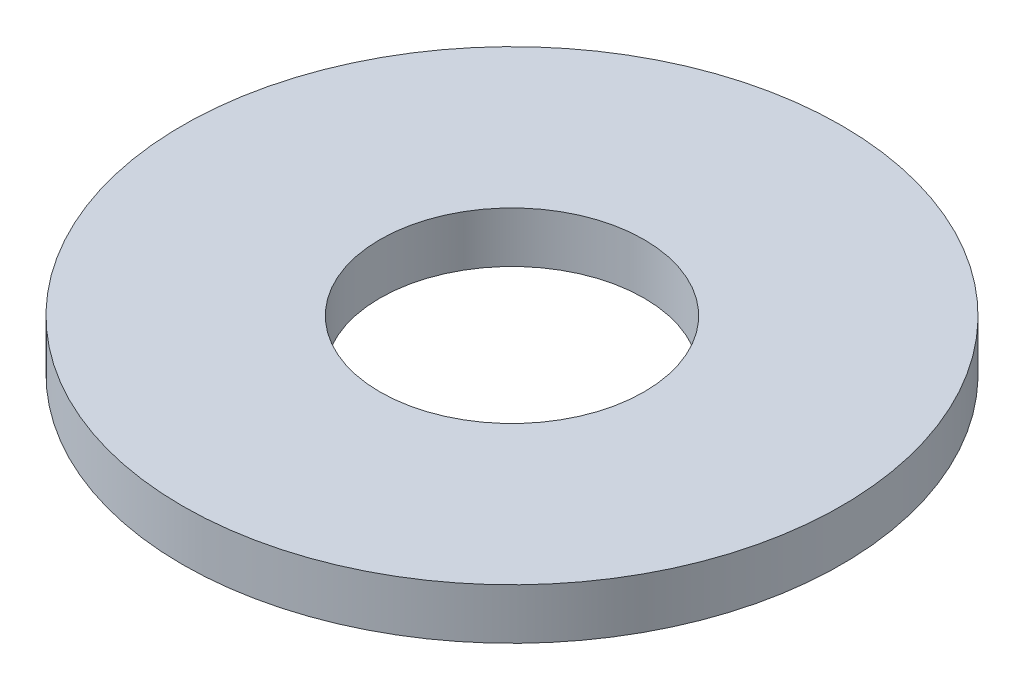
from build123d import *

# Parameters (mm, degrees)
SKETCH1_R           = 3.9624
BOSS_EXTRUDE1_DEPTH = 0.6096
SKETCH5_R           = 1.5875
CUT_EXTRUDE1_DEPTH  = 6.636740164


with BuildPart() as part:
    # Sketch1 → Boss-Extrude1 (new body)
    with BuildSketch(Plane(origin=(0, 0, 0), x_dir=(1, 0, 0), z_dir=(0, 1, 0))):
        with Locations(Location((0, 0, 0), (0, 0, 270))):
            Circle(SKETCH1_R)
    extrude(amount=BOSS_EXTRUDE1_DEPTH)

    # Sketch5 → Cut-Extrude1 (cut, through all)
    with BuildSketch(Plane(origin=(0, 0.6096, 0), x_dir=(-1, 0, 0), z_dir=(0, 1, 0))):
        with Locations(Location((0, 0, 0), (0, 0, 90))):
            Circle(SKETCH5_R)
    extrude(amount=-CUT_EXTRUDE1_DEPTH, mode=Mode.SUBTRACT)


solid = part.part
